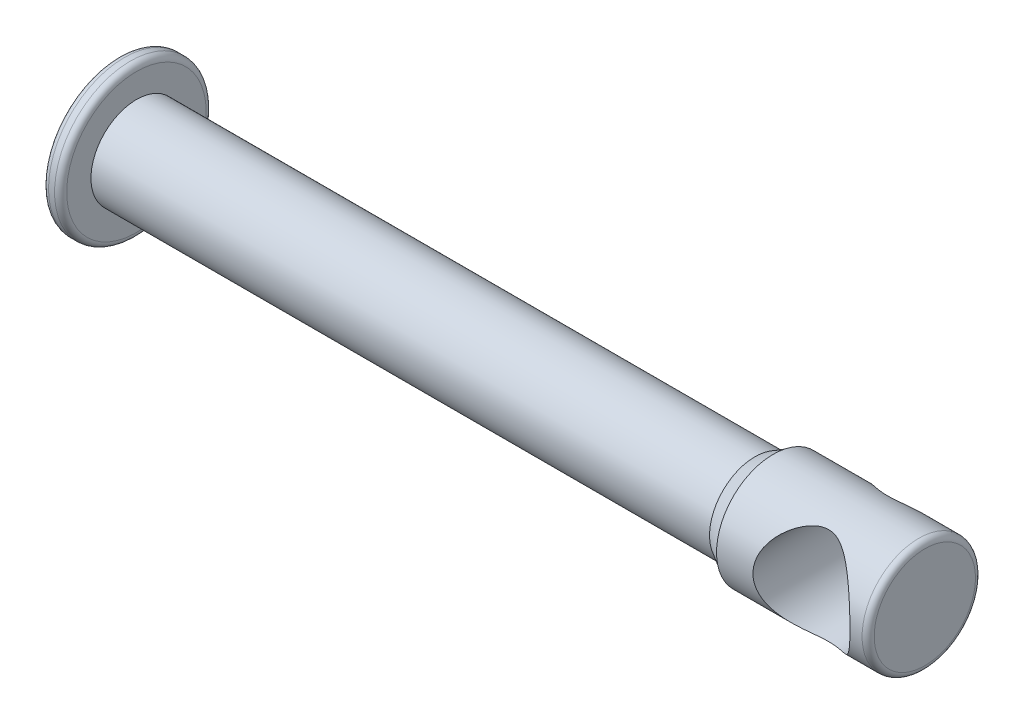
from build123d import *

# Parameters (mm, degrees)
CHAMFER1_SIZE           = 3
CHAMFER1_SIZE2          = 1.732050808
CUT_EXTRUDE1_DEPTH      = 135.169668703
CUT_EXTRUDE1_DEPTH_BACK = 135.169668703
SKETCH2_R               = 8
FILLET1_R               = 1


with BuildPart() as part:
    # Sketch1 → Revolve1 (revolve)
    with BuildSketch(Plane(origin=(0, 0, 0), x_dir=(1, 0, 0), z_dir=(0, 1, 0))):
        Polygon((0, 0), (0, 12.5), (3, 12.5), (3, 7.5), (108, 7.5), (108, 9.35), (133, 9.35), (133, 0), align=None)
    revolve(axis=Axis((133, 0, 0), (-1, 0, 0)))

    # Chamfer1
    chamfer1_edges = [part.edges().sort_by_distance(p)[0] for p in [
        (108, 0, 7.5),
    ]]
    chamfer1_side = [part.faces().sort_by_distance(p)[0] for p in [
        (55.5, 0, 7.5),
    ]]
    chamfer(chamfer1_edges, length=CHAMFER1_SIZE, length2=CHAMFER1_SIZE2, reference=chamfer1_side[0])

    # Sketch2 → Cut-Extrude1 (cut, two sides: drawn at the far end of the back side and taken through both)
    with BuildSketch(Plane.XY.offset(-CUT_EXTRUDE1_DEPTH_BACK)):
        with Locations((122, 0)):
            Circle(SKETCH2_R)
    extrude(amount=CUT_EXTRUDE1_DEPTH + CUT_EXTRUDE1_DEPTH_BACK, mode=Mode.SUBTRACT)

    # Fillet1
    fillet1_edges = [part.edges().sort_by_distance(p)[0] for p in [
        (133, 0, 9.35),
        (3, 0, 12.5),
        (0, 0, 12.5),
    ]]
    fillet(fillet1_edges, radius=FILLET1_R)


solid = part.part
